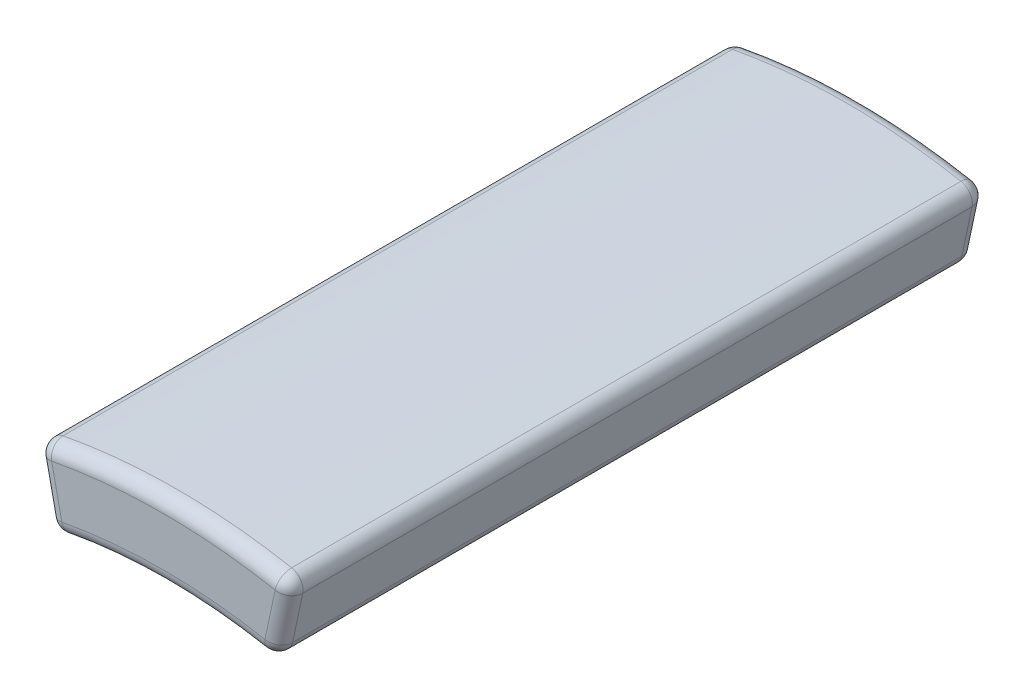
from build123d import *

# Parameters (mm, degrees)
BOSS_EXTRUDE2_DEPTH = 10
FILLET1_R           = 0.4


with BuildPart() as part:
    # Sketch4 → Boss-Extrude2 (new, symmetric)
    with BuildSketch(Plane.XY):
        with BuildLine():
            Line((-3.680036927, 0.713212533), (-3.222631208, -1.438712189))
            ThreePointArc((-3.222631208, -1.438712189), (0, -1.1), (3.222631208, -1.438712189))
            Line((3.222631208, -1.438712189), (3.680036927, 0.713212533))
            ThreePointArc((3.680036927, 0.713212533), (0, 1.1), (-3.680036927, 0.713212533))
        make_face()
    extrude(amount=BOSS_EXTRUDE2_DEPTH, both=True)

    # Fillet1
    fillet1_edges = [part.edges().sort_by_distance(p)[0] for p in [
        (0, 1.1, 10),
        (-3.451334068, -0.362749828, 10),
        (0, -1.1, 10),
        (-3.451334068, -0.362749828, -10),
        (0, 1.1, -10),
        (3.451334068, -0.362749828, -10),
        (0, -1.1, -10),
        (-3.222631208, -1.438712189, 0),
        (-3.680036927, 0.713212533, 0),
        (3.680036927, 0.713212533, 0),
        (3.222631208, -1.438712189, 0),
        (3.451334068, -0.362749828, 10),
    ]]
    fillet(fillet1_edges, radius=FILLET1_R)


solid = part.part
